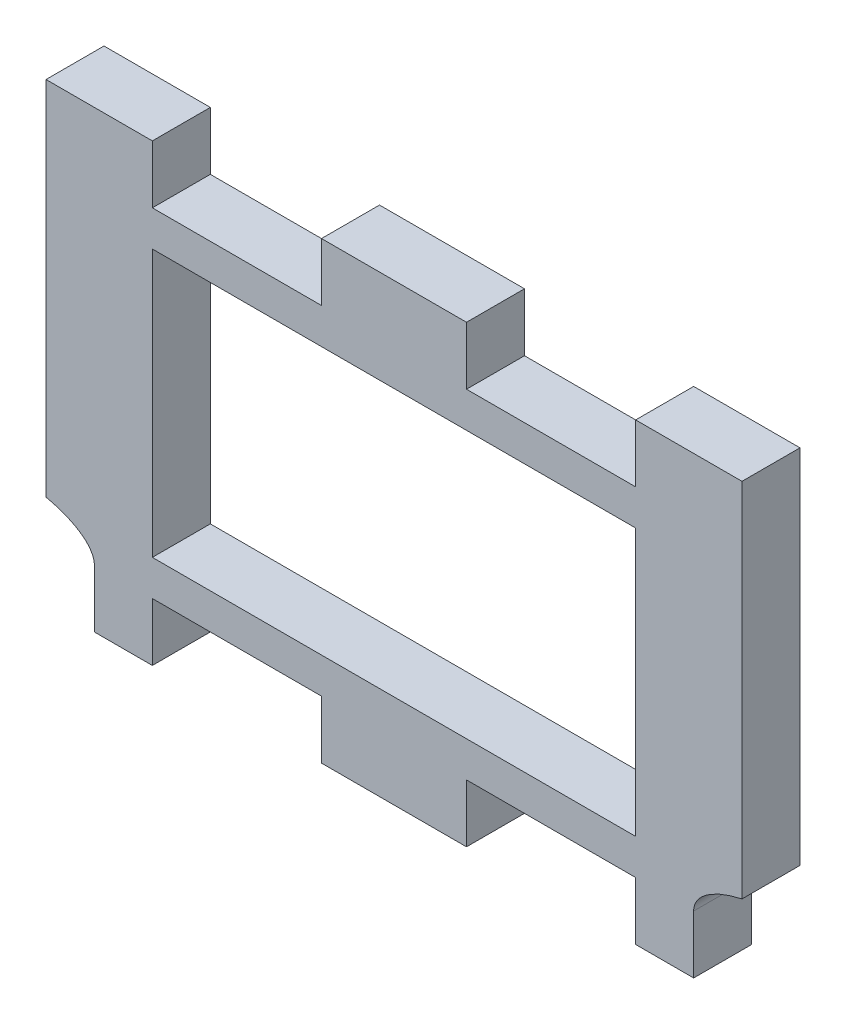
from build123d import *

# Parameters (mm, degrees)
BOSS_EXTRUDE1_DEPTH = 6
SKETCH4_W           = 50
SKETCH4_H           = 27.629262186
CUT_EXTRUDE1_DEPTH  = 90.560035874


with BuildPart() as part:
    # Sketch2 → Boss-Extrude1 (new body)
    with BuildSketch(Plane.XY):
        with BuildLine():
            Line((-15, 0), (-9, 0))
            Line((-9, 0), (-9, 6))
            add(Edge.make_bspline(
                [(-4, 9.583225666), (-9, 8.480694692), (-9, 6)],
                knots=[5.172942972, 5.172942972, 5.172942972, 6.283185307, 6.283185307, 6.283185307], degree=2, weights=[1, 0.849836586, 1]))
            Line((-4, 9.583225666), (-4, 41))
            Line((-4, 41), (-4, 47))
            Line((-4, 47), (-15, 47))
            Line((-15, 47), (-15, 41))
            Line((-15, 41), (-32.5, 41))
            Line((-32.5, 41), (-32.5, 47))
            Line((-32.5, 47), (-47.5, 47))
            Line((-47.5, 47), (-47.5, 41))
            Line((-47.5, 41), (-65, 41))
            Line((-65, 41), (-65, 47))
            Line((-65, 47), (-76, 47))
            Line((-76, 47), (-76, 41))
            Line((-76, 41), (-76, 9.583225666))
            add(Edge.make_bspline(
                [(-71, 6), (-71, 8.480694692), (-76, 9.583225666)],
                knots=[0, 0, 0, 1.110242335, 1.110242335, 1.110242335], degree=2, weights=[1, 0.849836586, 1]))
            Line((-71, 6), (-71, 0))
            Line((-71, 0), (-65, 0))
            Line((-65, 0), (-65, 6))
            Line((-65, 6), (-47.5, 6))
            Line((-47.5, 6), (-47.5, 0))
            Line((-47.5, 0), (-32.5, 0))
            Line((-32.5, 0), (-32.5, 6))
            Line((-32.5, 6), (-15, 6))
            Line((-15, 6), (-15, 0))
        make_face()
    extrude(amount=BOSS_EXTRUDE1_DEPTH)

    # Sketch4 → Cut-Extrude1 (cut, through all)
    with BuildSketch(Plane(origin=(0, 0, 0), x_dir=(-1, 0, 0), z_dir=(0, 0, -1))):
        with Locations((40, 23.5)):
            Rectangle(SKETCH4_W, SKETCH4_H)
    extrude(amount=-CUT_EXTRUDE1_DEPTH, mode=Mode.SUBTRACT)


solid = part.part
